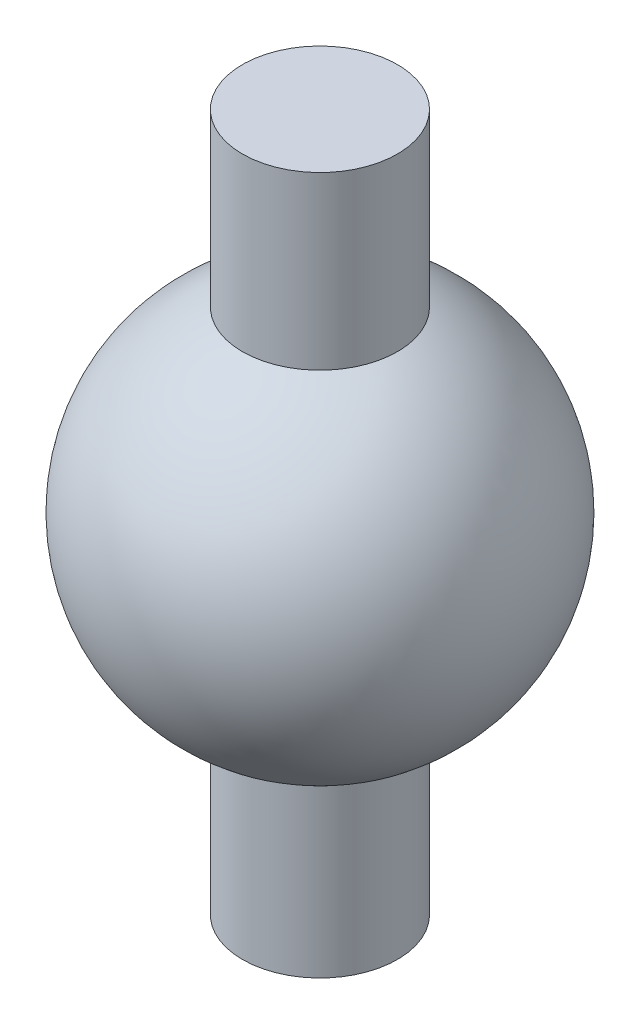
from build123d import *


with BuildPart() as part:
    # Sketch2 → Revolve1 (revolve)
    with BuildSketch(Plane(origin=(0, 0, 0), x_dir=(0, 0, -1), z_dir=(1, 0, 0))):
        with BuildLine():
            Line((-93.96421084, 110.343437059), (-93.96421084, 133.256315534))
            ThreePointArc((-93.96421084, 133.256315534), (-101.46421084, 121.799876296), (-93.96421084, 110.343437059))
        make_face()
        with BuildLine():
            Line((-88.96421084, 109.299876296), (-88.96421084, 134.299876296))
            ThreePointArc((-88.96421084, 134.299876296), (-91.518081386, 134.036205208), (-93.96421084, 133.256315534))
            Line((-93.96421084, 133.256315534), (-93.96421084, 110.343437059))
            ThreePointArc((-93.96421084, 110.343437059), (-91.518081386, 109.563547385), (-88.96421084, 109.299876296))
        make_face()
        with BuildLine():
            Line((-88.96421084, 134.299876296), (-88.96421084, 144.299876296))
            Line((-88.96421084, 144.299876296), (-93.96421084, 144.299876296))
            Line((-93.96421084, 144.299876296), (-93.96421084, 133.256315534))
            ThreePointArc((-93.96421084, 133.256315534), (-91.518081386, 134.036205208), (-88.96421084, 134.299876296))
        make_face()
        with BuildLine():
            Line((-88.96421084, 99.299876296), (-88.96421084, 109.299876296))
            ThreePointArc((-88.96421084, 109.299876296), (-91.518081386, 109.563547385), (-93.96421084, 110.343437059))
            Line((-93.96421084, 110.343437059), (-93.96421084, 99.299876296))
            Line((-93.96421084, 99.299876296), (-88.96421084, 99.299876296))
        make_face()
    revolve(axis=Axis((0, 144.299876296, 88.96421084), (0, -1, 0)))


solid = part.part
